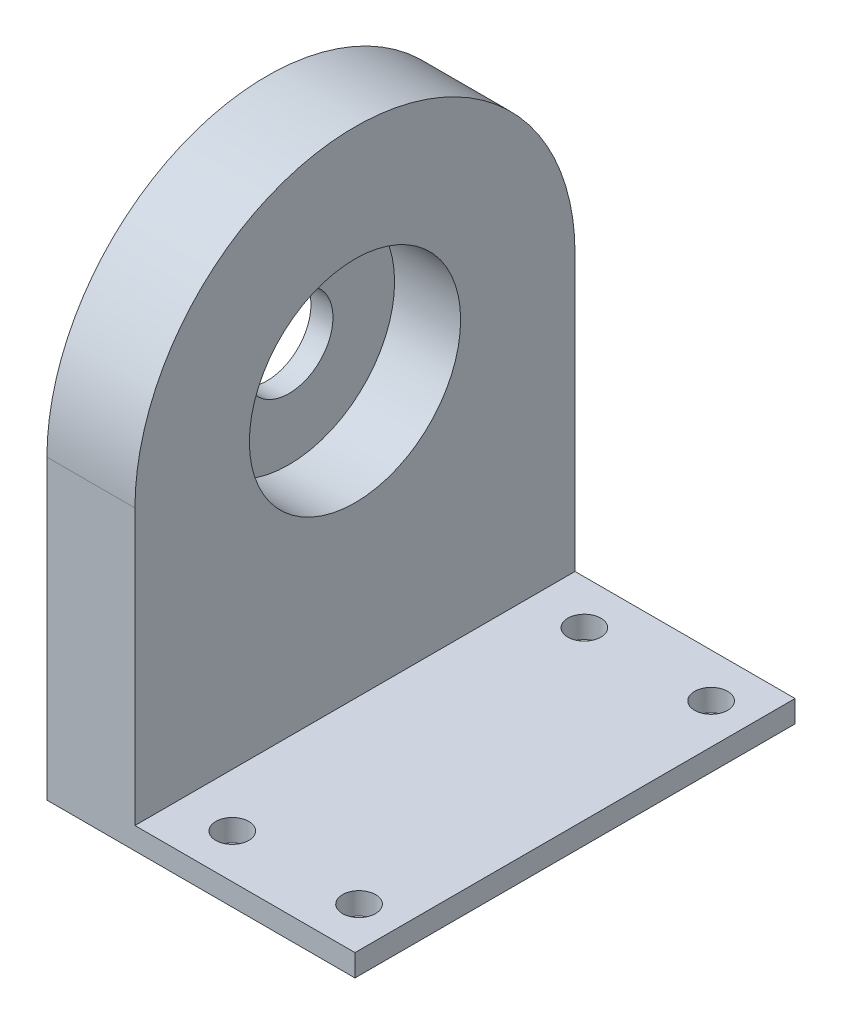
from build123d import *

# Parameters (mm, degrees)
BOSS_EXTRUDE1_DEPTH      = 6
BOSS_EXTRUDE1_DEPTH_BACK = 2
CUT_EXTRUDE1_DEPTH       = 6
SKETCH3_R                = 4
CUT_EXTRUDE2_DEPTH       = 10
SKETCH4_W                = 40
SKETCH4_H                = 2
BOSS_EXTRUDE2_DEPTH      = 20
SKETCH5_R                = 1.5
CUT_EXTRUDE3_DEPTH       = 10


with BuildPart() as part:
    # Sketch1 → Boss-Extrude1 (new, two sides: drawn at the far end of the back side and taken through both)
    with BuildSketch(Plane(origin=(0, 0, 0), x_dir=(0, 0, -1), z_dir=(1, 0, 0)).offset(-BOSS_EXTRUDE1_DEPTH_BACK)):
        with BuildLine():
            Line((-25.25, 9.083333333), (-25.25, -17.916666667))
            Line((-25.25, -17.916666667), (14.75, -17.916666667))
            Line((14.75, -17.916666667), (14.75, 9.083333333))
            ThreePointArc((14.75, 9.083333333), (-5.25, 29.083333333), (-25.25, 9.083333333))
        make_face()
    extrude(amount=BOSS_EXTRUDE1_DEPTH + BOSS_EXTRUDE1_DEPTH_BACK)

    # Sketch2 → Cut-Extrude1 (cut)
    with BuildSketch(Plane(origin=(6, 0, 0), x_dir=(0, 0, -1), z_dir=(1, 0, 0))):
        with BuildLine():
            ThreePointArc((4.35, 9.083333333), (-5.25, 18.683333333), (-14.85, 9.083333333))
            Line((-14.85, 9.083333333), (4.35, 9.083333333))
        make_face()
        with BuildLine():
            Line((4.35, 9.083333333), (-14.85, 9.083333333))
            ThreePointArc((-14.85, 9.083333333), (-5.25, -0.516666667), (4.35, 9.083333333))
        make_face()
    extrude(amount=-CUT_EXTRUDE1_DEPTH, mode=Mode.SUBTRACT)

    # Sketch3 → Cut-Extrude2 (cut)
    with BuildSketch(Plane(origin=(6, 0, 0), x_dir=(0, 0, -1), z_dir=(1, 0, 0))):
        with Locations((-5.25, 9.083333333)):
            Circle(SKETCH3_R)
    extrude(amount=-CUT_EXTRUDE2_DEPTH, mode=Mode.SUBTRACT)

    # Sketch4 → Boss-Extrude2 (add)
    with BuildSketch(Plane(origin=(6, 0, 0), x_dir=(0, 0, -1), z_dir=(1, 0, 0))):
        with Locations((-5.25, -16.916666667)):
            Rectangle(SKETCH4_W, SKETCH4_H)
    extrude(amount=BOSS_EXTRUDE2_DEPTH)

    # Sketch5 → Cut-Extrude3 (cut)
    with BuildSketch(Plane(origin=(0, -15.916666667, 0), x_dir=(1, 0, 0), z_dir=(0, 1, 0))):
        with Locations(Location((10.84792286, 10.75, 0), (0, 0, 270))):
            Circle(SKETCH5_R)
        with Locations(Location((22.368694263, 10.75, 0), (0, 0, 270))):
            Circle(SKETCH5_R)
        with Locations(Location((10.84792286, -21.25, 0), (0, 0, 270))):
            Circle(SKETCH5_R)
        with Locations(Location((22.368694263, -21.25, 0), (0, 0, 270))):
            Circle(SKETCH5_R)
    extrude(amount=-CUT_EXTRUDE3_DEPTH, mode=Mode.SUBTRACT)


solid = part.part
